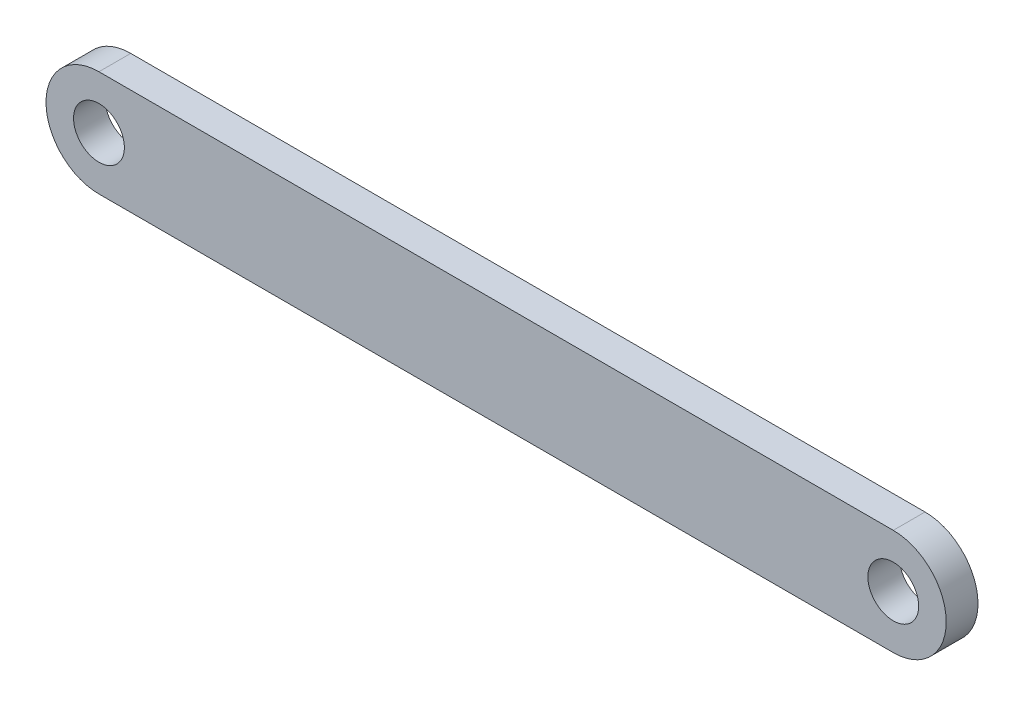
from build123d import *

# Parameters (mm, degrees)
SKETCH1_R           = 2.4
BOSS_EXTRUDE1_DEPTH = 3


with BuildPart() as part:
    # Sketch1 → Boss-Extrude1 (new body)
    with BuildSketch(Plane.XY):
        with BuildLine():
            Line((120.078651701, 190.032322866), (195.078651701, 190.032322866))
            ThreePointArc((195.078651701, 190.032322866), (200.078651701, 195.032322866), (195.078651701, 200.032322866))
            Line((195.078651701, 200.032322866), (120.078651701, 200.032322866))
            ThreePointArc((120.078651701, 200.032322866), (115.078651701, 195.032322866), (120.078651701, 190.032322866))
        make_face()
        with Locations((120.078651701, 195.032322866)):
            Circle(SKETCH1_R, mode=Mode.SUBTRACT)
        with Locations((195.078651701, 195.032322866)):
            Circle(SKETCH1_R, mode=Mode.SUBTRACT)
    extrude(amount=BOSS_EXTRUDE1_DEPTH)


solid = part.part
